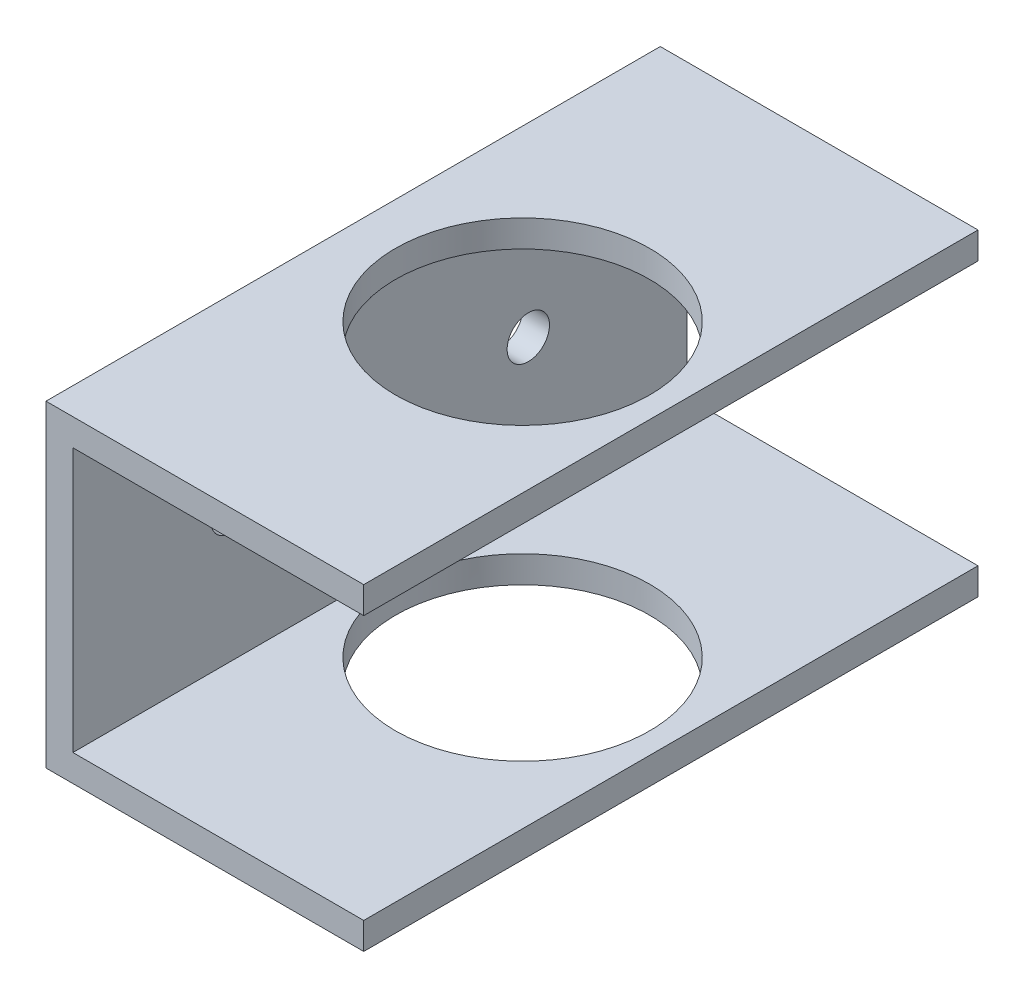
from build123d import *

# Parameters (mm, degrees)
BOSS_EXTRUDE1_DEPTH = 145
SKETCH2_R           = 30
CUT_EXTRUDE1_DEPTH  = 180.652442232
SKETCH3_R           = 5
CUT_EXTRUDE2_DEPTH  = 10


with BuildPart() as part:
    # Sketch1 → Boss-Extrude1 (new body)
    with BuildSketch(Plane.XY):
        Polygon((0, -37.5), (0, 37.5), (75, 37.5), (75, 31.15), (6.35, 31.15), (6.35, -31.15), (75, -31.15), (75, -37.5), align=None)
    extrude(amount=BOSS_EXTRUDE1_DEPTH)

    # Sketch2 → Cut-Extrude1 (cut, through all)
    with BuildSketch(Plane(origin=(0, 37.5, 0), x_dir=(1, 0, 0), z_dir=(0, 1, 0))):
        with Locations(Location((40, -72.5, 0), (0, 0, 270))):
            Circle(SKETCH2_R)
    extrude(amount=-CUT_EXTRUDE1_DEPTH, mode=Mode.SUBTRACT)

    # Sketch3 → Cut-Extrude2 (cut)
    with BuildSketch(Plane(origin=(6.35, 0, 0), x_dir=(0, 0, -1), z_dir=(1, 0, 0))):
        with Locations((-107.5, 0)):
            Circle(SKETCH3_R)
        with Locations((-37.5, 0)):
            Circle(SKETCH3_R)
    extrude(amount=-CUT_EXTRUDE2_DEPTH, mode=Mode.SUBTRACT)


solid = part.part
